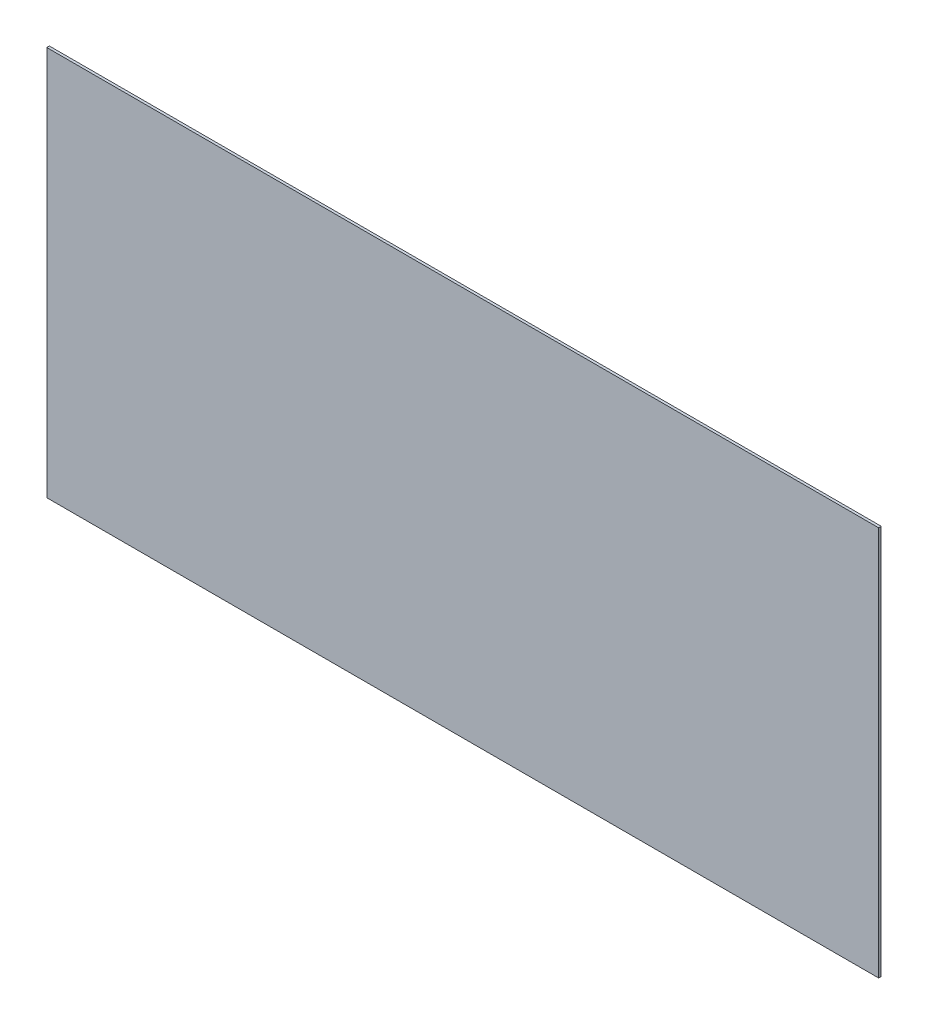
from build123d import *

# Parameters (mm, degrees)
SKETCH1_W           = 640
SKETCH1_H           = 300
BOSS_EXTRUDE1_DEPTH = 2


with BuildPart() as part:
    # Sketch1 → Boss-Extrude1 (new body)
    with BuildSketch(Plane.XY):
        with Locations((320, -150)):
            Rectangle(SKETCH1_W, SKETCH1_H)
    extrude(amount=BOSS_EXTRUDE1_DEPTH)


solid = part.part
